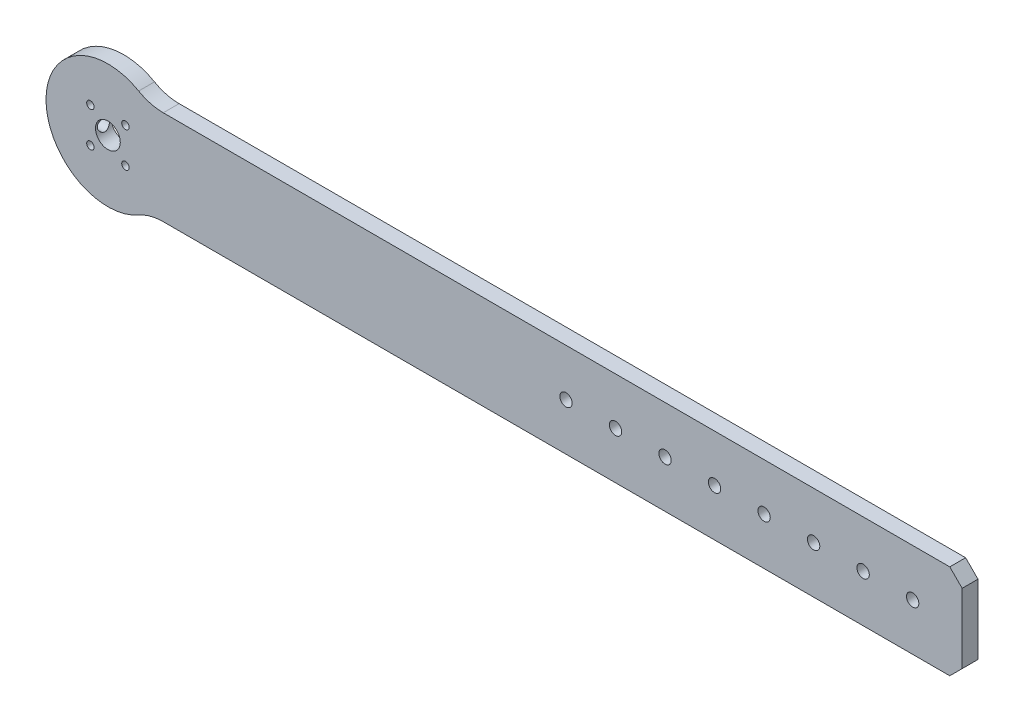
from build123d import *

# Parameters (mm, degrees)
SKETCH1_R           = 1.5
SKETCH1_R_2         = 2.5
SKETCH1_R_3         = 5
BOSS_EXTRUDE1_DEPTH = 3.2
SKETCH4_R           = 2.5
CUT_EXTRUDE1_DEPTH  = 32.4
FILLET1_R           = 20
CHAMFER1_SIZE       = 5


with BuildPart() as part:
    # Sketch1 → Boss-Extrude1 (new, symmetric)
    with BuildSketch(Plane.XY):
        with BuildLine():
            Line((345, 19.05), (16.189425561, 19.05))
            ThreePointArc((16.189425561, 19.05), (-25, 0), (16.189425561, -19.05))
            Line((16.189425561, -19.05), (345, -19.05))
            Line((345, -19.05), (345, 19.05))
        make_face()
        with Locations((7.071067812, 7.071067812)):
            Circle(SKETCH1_R, mode=Mode.SUBTRACT)
        with Locations((7.071067812, -7.071067812)):
            Circle(SKETCH1_R, mode=Mode.SUBTRACT)
        with Locations((-7.071067812, -7.071067812)):
            Circle(SKETCH1_R, mode=Mode.SUBTRACT)
        with Locations((-7.071067812, 7.071067812)):
            Circle(SKETCH1_R, mode=Mode.SUBTRACT)
        with Locations((325, 0)):
            Circle(SKETCH1_R_2, mode=Mode.SUBTRACT)
        with Locations((305, 0)):
            Circle(SKETCH1_R_2, mode=Mode.SUBTRACT)
        with Locations((285, 0)):
            Circle(SKETCH1_R_2, mode=Mode.SUBTRACT)
        with Locations((265, 0)):
            Circle(SKETCH1_R_2, mode=Mode.SUBTRACT)
        with Locations((245, 0)):
            Circle(SKETCH1_R_2, mode=Mode.SUBTRACT)
        with Locations((225, 0)):
            Circle(SKETCH1_R_2, mode=Mode.SUBTRACT)
        with Locations((205, 0)):
            Circle(SKETCH1_R_2, mode=Mode.SUBTRACT)
        with Locations((185, 0)):
            Circle(SKETCH1_R_2, mode=Mode.SUBTRACT)
        Circle(SKETCH1_R_3, mode=Mode.SUBTRACT)
    extrude(amount=BOSS_EXTRUDE1_DEPTH, both=True)

    # Sketch4 → Cut-Extrude1 (cut)
    with BuildSketch(Plane(origin=(0, 0, 0), x_dir=(0, 0, -1), z_dir=(1, 0, 0))):
        Circle(SKETCH4_R)
    extrude(amount=-CUT_EXTRUDE1_DEPTH, mode=Mode.SUBTRACT)

    # Fillet1
    fillet1_edges = [part.edges().sort_by_distance(p)[0] for p in [
        (16.189425561, -19.05, 0),
        (16.189425561, 19.05, 0),
    ]]
    fillet(fillet1_edges, radius=FILLET1_R)

    # Chamfer1
    chamfer1_edges = [part.edges().sort_by_distance(p)[0] for p in [
        (345, -19.05, 0),
        (345, 19.05, 0),
    ]]
    chamfer(chamfer1_edges, length=CHAMFER1_SIZE)


solid = part.part
